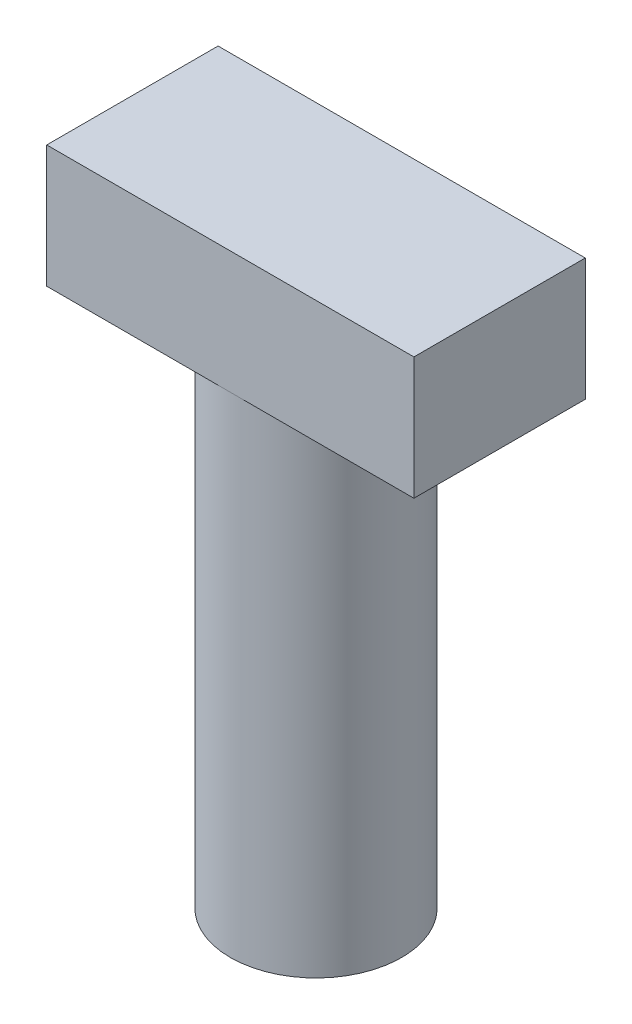
from build123d import *

# Parameters (mm, degrees)
SKETCH1_R           = 7
BOSS_EXTRUDE1_DEPTH = 40
SKETCH2_W           = 30
SKETCH2_H           = 14
BOSS_EXTRUDE2_DEPTH = 10


with BuildPart() as part:
    # Sketch1 → Boss-Extrude1 (new body)
    with BuildSketch(Plane(origin=(0, 0, 0), x_dir=(1, 0, 0), z_dir=(0, 1, 0))):
        with Locations(Location((0, 0, 0), (0, 0, 270))):
            Circle(SKETCH1_R)
    extrude(amount=BOSS_EXTRUDE1_DEPTH)

    # Sketch2 → Boss-Extrude2 (add)
    with BuildSketch(Plane(origin=(0, 40, 0), x_dir=(1, 0, 0), z_dir=(0, 1, 0))):
        Rectangle(SKETCH2_W, SKETCH2_H)
    extrude(amount=BOSS_EXTRUDE2_DEPTH)


solid = part.part
